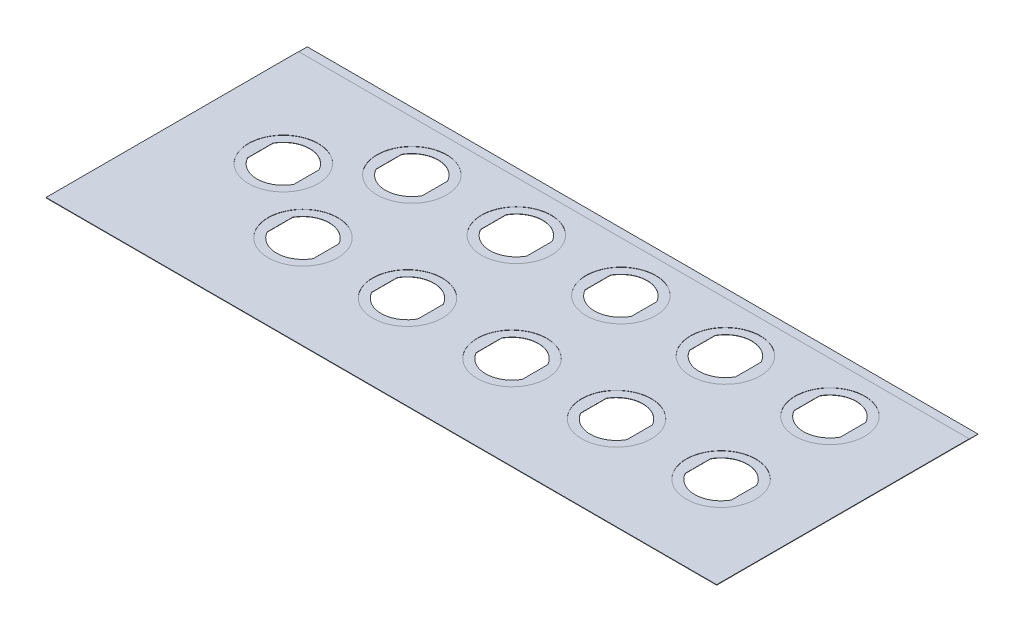
from build123d import *

# Parameters (mm, degrees)
SKETCH1_W           = 154
SKETCH1_H           = 60
BOSS_EXTRUDE1_DEPTH = 0.1
CUT_EXTRUDE1_DEPTH  = 83.63782427
SKETCH3_R           = 8
SKETCH3_W           = 154
SKETCH3_H           = 2
CUT_EXTRUDE2_DEPTH  = 0.05


with BuildPart() as part:
    # Sketch1 → Boss-Extrude1 (new body)
    with BuildSketch(Plane(origin=(0, 0, 0), x_dir=(1, 0, 0), z_dir=(0, 1, 0))):
        Rectangle(SKETCH1_W, SKETCH1_H)
    extrude(amount=BOSS_EXTRUDE1_DEPTH)

    # Sketch2 → Cut-Extrude1 (cut, through all)
    with BuildSketch(Plane(origin=(0, 0.1, 0), x_dir=(1, 0, 0), z_dir=(0, 1, 0))):
        with BuildLine():
            Line((51.2, 19.417618892), (51.2, 13.582381108))
            ThreePointArc((51.2, 13.582381108), (56.5, 10.45), (61.8, 13.582381108))
            Line((61.8, 13.582381108), (61.8, 19.417618892))
            ThreePointArc((61.8, 19.417618892), (56.5, 22.55), (51.2, 19.417618892))
        make_face()
        with BuildLine():
            Line((37.8, 19.417618892), (37.8, 13.582381108))
            ThreePointArc((37.8, 13.582381108), (32.5, 10.45), (27.2, 13.582381108))
            Line((27.2, 13.582381108), (27.2, 19.417618892))
            ThreePointArc((27.2, 19.417618892), (32.5, 22.55), (37.8, 19.417618892))
        make_face()
        with BuildLine():
            Line((13.8, 19.417618892), (13.8, 13.582381108))
            ThreePointArc((13.8, 13.582381108), (8.5, 10.45), (3.2, 13.582381108))
            Line((3.2, 13.582381108), (3.2, 19.417618892))
            ThreePointArc((3.2, 19.417618892), (8.5, 22.55), (13.8, 19.417618892))
        make_face()
        with BuildLine():
            Line((-10.2, 19.417618892), (-10.2, 13.582381108))
            ThreePointArc((-10.2, 13.582381108), (-15.5, 10.45), (-20.8, 13.582381108))
            Line((-20.8, 13.582381108), (-20.8, 19.417618892))
            ThreePointArc((-20.8, 19.417618892), (-15.5, 22.55), (-10.2, 19.417618892))
        make_face()
        with BuildLine():
            Line((-34.2, 19.417618892), (-34.2, 13.582381108))
            ThreePointArc((-34.2, 13.582381108), (-39.5, 10.45), (-44.8, 13.582381108))
            Line((-44.8, 13.582381108), (-44.8, 19.417618892))
            ThreePointArc((-44.8, 19.417618892), (-39.5, 22.55), (-34.2, 19.417618892))
        make_face()
        with BuildLine():
            Line((37.8, -5.582381108), (37.8, -11.417618892))
            ThreePointArc((37.8, -11.417618892), (32.5, -14.55), (27.2, -11.417618892))
            Line((27.2, -11.417618892), (27.2, -5.582381108))
            ThreePointArc((27.2, -5.582381108), (32.5, -2.45), (37.8, -5.582381108))
        make_face()
        with BuildLine():
            Line((13.8, -5.582381108), (13.8, -11.417618892))
            ThreePointArc((13.8, -11.417618892), (8.5, -14.55), (3.2, -11.417618892))
            Line((3.2, -11.417618892), (3.2, -5.582381108))
            ThreePointArc((3.2, -5.582381108), (8.5, -2.45), (13.8, -5.582381108))
        make_face()
        with BuildLine():
            Line((-10.2, -5.582381108), (-10.2, -11.417618892))
            ThreePointArc((-10.2, -11.417618892), (-15.5, -14.55), (-20.8, -11.417618892))
            Line((-20.8, -11.417618892), (-20.8, -5.582381108))
            ThreePointArc((-20.8, -5.582381108), (-15.5, -2.45), (-10.2, -5.582381108))
        make_face()
        with BuildLine():
            Line((-34.2, -5.582381108), (-34.2, -11.417618892))
            ThreePointArc((-34.2, -11.417618892), (-39.5, -14.55), (-44.8, -11.417618892))
            Line((-44.8, -11.417618892), (-44.8, -5.582381108))
            ThreePointArc((-44.8, -5.582381108), (-39.5, -2.45), (-34.2, -5.582381108))
        make_face()
        with BuildLine():
            Line((61.8, -5.582381108), (61.8, -11.417618892))
            ThreePointArc((61.8, -11.417618892), (56.5, -14.55), (51.2, -11.417618892))
            Line((51.2, -11.417618892), (51.2, -5.582381108))
            ThreePointArc((51.2, -5.582381108), (56.5, -2.45), (61.8, -5.582381108))
        make_face()
        with BuildLine():
            Line((-51.2, 6.917618892), (-51.2, 1.082381108))
            ThreePointArc((-51.2, 1.082381108), (-56.5, -2.05), (-61.8, 1.082381108))
            Line((-61.8, 1.082381108), (-61.8, 6.917618892))
            ThreePointArc((-61.8, 6.917618892), (-56.5, 10.05), (-51.2, 6.917618892))
        make_face()
    extrude(amount=-CUT_EXTRUDE1_DEPTH, mode=Mode.SUBTRACT)

    # Sketch3 → Cut-Extrude2 (cut)
    with BuildSketch(Plane(origin=(0, 0.1, 0), x_dir=(1, 0, 0), z_dir=(0, 1, 0))):
        with Locations(Location((-56.5, 4, 0), (0, 0, 270))):
            Circle(SKETCH3_R)
        with Locations(Location((56.5, 16.5, 0), (0, 0, 270))):
            Circle(SKETCH3_R)
        with Locations(Location((32.5, 16.5, 0), (0, 0, 270))):
            Circle(SKETCH3_R)
        with Locations(Location((8.5, 16.5, 0), (0, 0, 270))):
            Circle(SKETCH3_R)
        with Locations(Location((-15.5, 16.5, 0), (0, 0, 270))):
            Circle(SKETCH3_R)
        with Locations(Location((-39.5, 16.5, 0), (0, 0, 270))):
            Circle(SKETCH3_R)
        with Locations(Location((32.5, -8.5, 0), (0, 0, 270))):
            Circle(SKETCH3_R)
        with Locations(Location((8.5, -8.5, 0), (0, 0, 270))):
            Circle(SKETCH3_R)
        with Locations(Location((-15.5, -8.5, 0), (0, 0, 270))):
            Circle(SKETCH3_R)
        with Locations(Location((-39.5, -8.5, 0), (0, 0, 270))):
            Circle(SKETCH3_R)
        with Locations(Location((56.5, -8.5, 0), (0, 0, 270))):
            Circle(SKETCH3_R)
        with Locations((0, 29)):
            Rectangle(SKETCH3_W, SKETCH3_H)
    extrude(amount=-CUT_EXTRUDE2_DEPTH, mode=Mode.SUBTRACT)


solid = part.part
